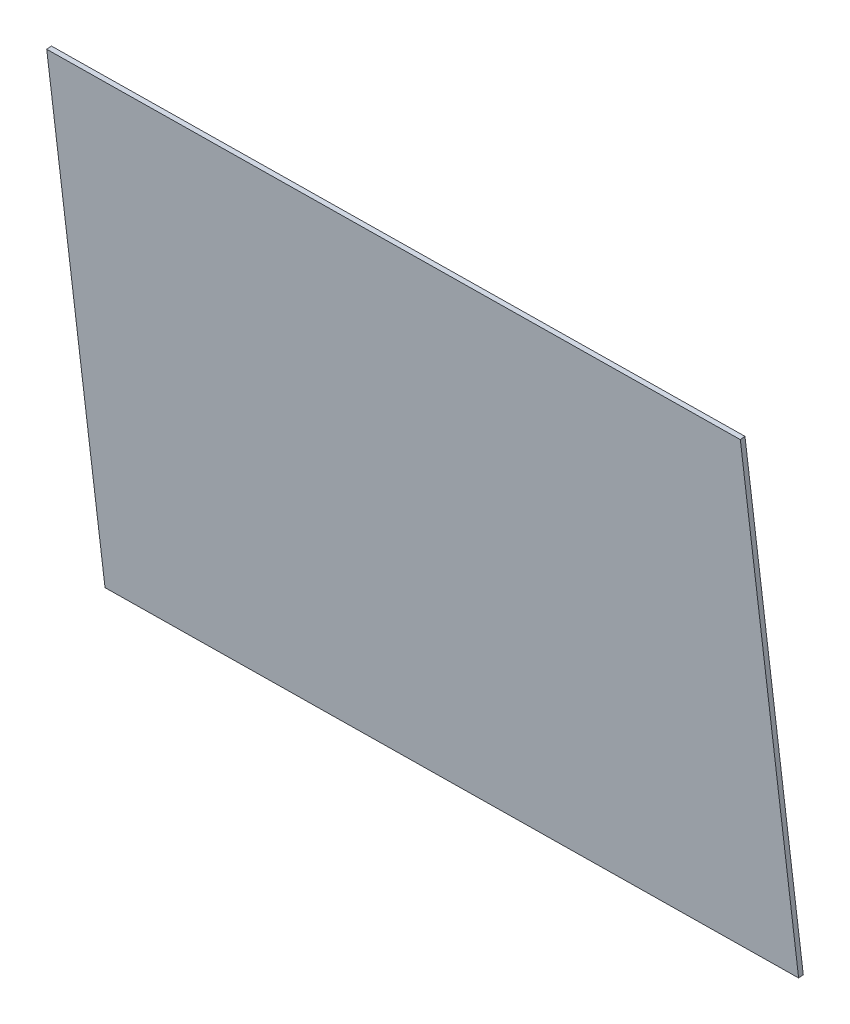
from build123d import *

# Parameters (mm, degrees)
BOSS_EXTRUDE1_DEPTH = 2


with BuildPart() as part:
    # Sketch1 → Boss-Extrude1 (new body)
    with BuildSketch(Plane(origin=(0, 20.895452563, -198.806951122), x_dir=(1, 0, 0), z_dir=(0, -0.10452846326765321, 0.9945218953682734))):
        Polygon((129.905594056, -701.796272384), (426.875758738, -697.58660623), (429.852290362, -907.56551055), (132.882125681, -911.775176704), align=None)
    extrude(amount=BOSS_EXTRUDE1_DEPTH)


solid = part.part
